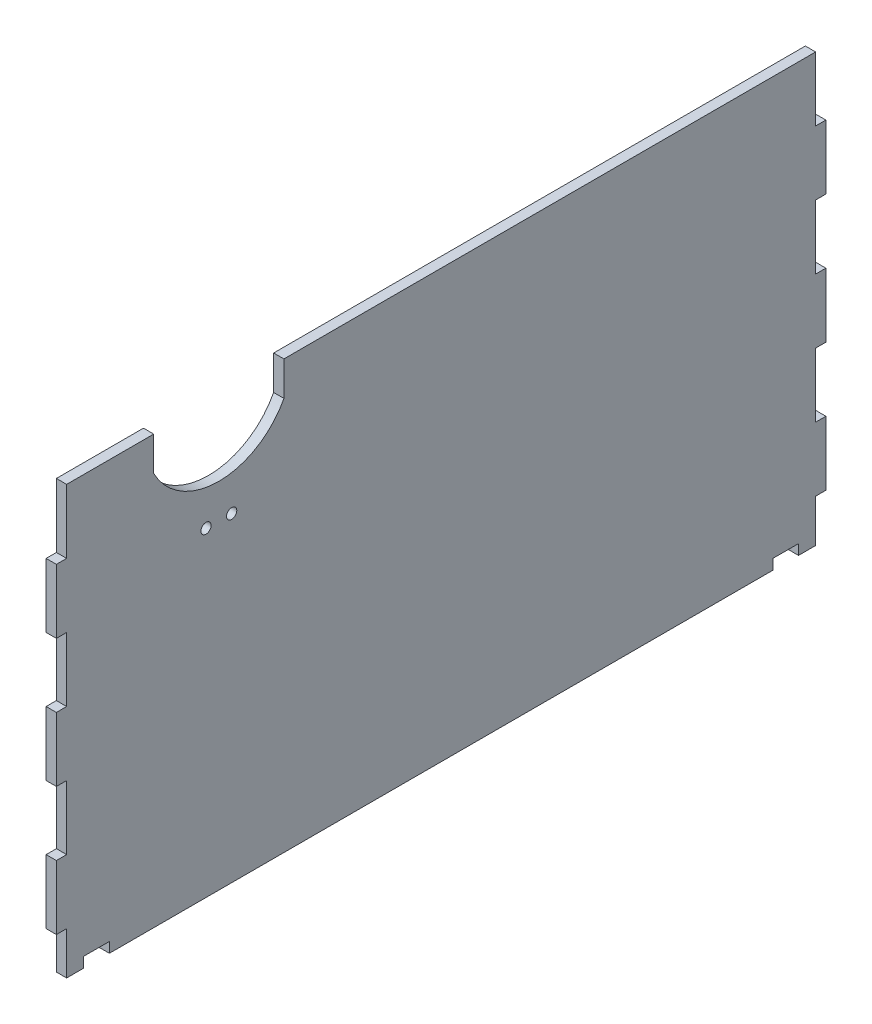
from build123d import *

# Parameters (mm, degrees)
SKETCH1_W            = 450
SKETCH1_H            = 250
BOSS_EXTRUDE1_DEPTH  = 6
SKETCH2_W            = 6
SKETCH2_H            = 37.5
CUT_EXTRUDE1_DEPTH   = 515.816472153
LPATTERN1_COUNT      = 4
LPATTERN1_PITCH      = 75
LPATTERN1_COUNT_DIR2 = 2
LPATTERN1_PITCH_DIR2 = 444
SKETCH3_W            = 15
SKETCH3_H            = 6
CUT_EXTRUDE2_DEPTH   = 515.816472153
LPATTERN2_COUNT      = 2
LPATTERN2_PITCH      = 403
SKETCH4_R            = 3
CUT_EXTRUDE3_DEPTH   = 10


with BuildPart() as part:
    # Sketch1 → Boss-Extrude1 (new body)
    with BuildSketch(Plane(origin=(0, 0, 0), x_dir=(0, 0, -1), z_dir=(1, 0, 0))):
        with Locations((-225, 125)):
            Rectangle(SKETCH1_W, SKETCH1_H)
    extrude(amount=BOSS_EXTRUDE1_DEPTH)

    # Sketch2 → Cut-Extrude1 (cut, through all)
    with BuildSketch(Plane(origin=(6, 0, 0), x_dir=(0, 0, -1), z_dir=(1, 0, 0))):
        with Locations((-447, 231.25)):
            Rectangle(SKETCH2_W, SKETCH2_H)
    cut_extrude1 = extrude(amount=-CUT_EXTRUDE1_DEPTH, mode=Mode.SUBTRACT)

    # LPattern1: Cut-Extrude1 4 × 2
    with Locations(*[(0, -i * LPATTERN1_PITCH, -j * LPATTERN1_PITCH_DIR2) for i in range(LPATTERN1_COUNT) for j in range(LPATTERN1_COUNT_DIR2) if (i, j) != (0, 0)]):
        add(cut_extrude1, mode=Mode.SUBTRACT)

    # Sketch3 → Cut-Extrude2 (cut, through all)
    with BuildSketch(Plane(origin=(6, 0, 0), x_dir=(0, 0, -1), z_dir=(1, 0, 0))):
        with Locations((-426.5, 3)):
            Rectangle(SKETCH3_W, SKETCH3_H)
    cut_extrude2 = extrude(amount=-CUT_EXTRUDE2_DEPTH, mode=Mode.SUBTRACT)

    # LPattern2: Cut-Extrude2 ×2
    with Locations(*[(0, 0, -i * LPATTERN2_PITCH) for i in range(1, LPATTERN2_COUNT)]):
        add(cut_extrude2, mode=Mode.SUBTRACT)

    # Sketch4 → Cut-Extrude3 (cut)
    with BuildSketch(Plane(origin=(6, 0, 0), x_dir=(0, 0, -1), z_dir=(1, 0, 0))):
        with Locations((-362.5, 187)):
            Circle(SKETCH4_R)
        with Locations((-347.5, 187)):
            Circle(SKETCH4_R)
        with BuildLine():
            Line((-393.065732621, 230), (-393.065732621, 250))
            Line((-393.065732621, 250), (-316.934267379, 250))
            Line((-316.934267379, 250), (-316.934267379, 230))
            ThreePointArc((-316.934267379, 230), (-355, 207), (-393.065732621, 230))
        make_face()
    extrude(amount=-CUT_EXTRUDE3_DEPTH, mode=Mode.SUBTRACT)


solid = part.part
